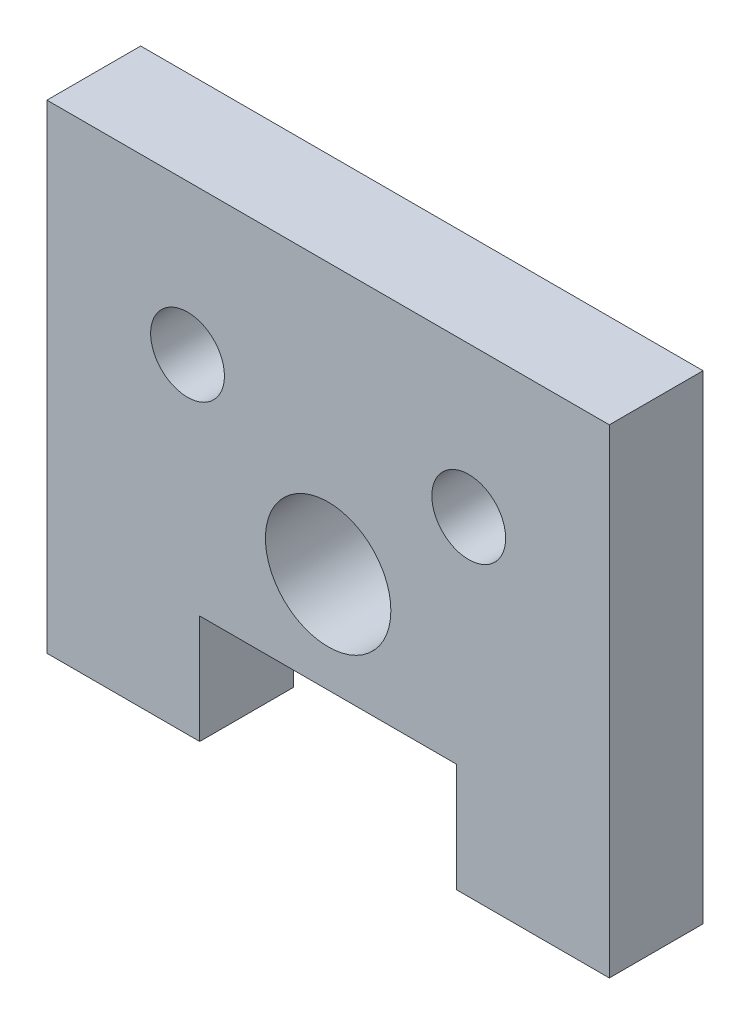
from build123d import *

# Parameters (mm, degrees)
SKETCH1_R           = 5
BOSS_EXTRUDE2_DEPTH = 12.7


with BuildPart() as part:
    # Sketch1 → Boss-Extrude2 (new body)
    with BuildSketch(Plane.XY):
        Polygon((-38.1, -36.576), (-17.399, -36.576), (-17.399, -21.844), (0, -21.844), (17.399, -21.844), (17.399, -36.576), (38.1, -36.576), (38.1, 28.336368082), (-19.05, 28.336368082), (-38.1, 28.336368082), align=None)
        with BuildLine():
            ThreePointArc((8.5, -8.264), (6.01040764, -14.27440764), (0, -16.764))
            ThreePointArc((0, -16.764), (-6.01040764, -2.25359236), (8.5, -8.264))
        make_face(mode=Mode.SUBTRACT)
        with Locations((-19.05, 7.992)):
            Circle(SKETCH1_R, mode=Mode.SUBTRACT)
        with Locations((19.05, 7.992)):
            Circle(SKETCH1_R, mode=Mode.SUBTRACT)
    extrude(amount=BOSS_EXTRUDE2_DEPTH)


solid = part.part
